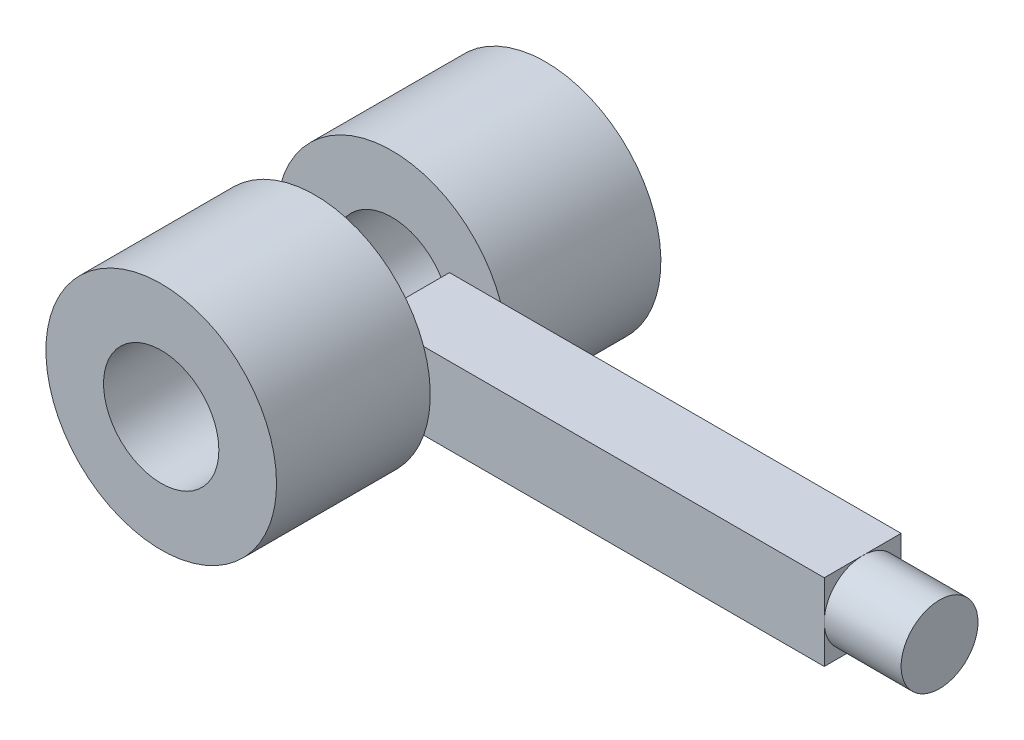
from build123d import *

# Parameters (mm, degrees)
SKETCH1_R           = 3
SKETCH1_R_2         = 1.5
BOSS_EXTRUDE1_DEPTH = 4
SKETCH2_R           = 3
SKETCH2_R_2         = 1.5
BOSS_EXTRUDE2_DEPTH = 4
BOSS_EXTRUDE3_REACH = 9.348
SKETCH3_W           = 1
SKETCH3_H           = 2
SKETCH4_W           = 2
SKETCH4_H           = 2
BOSS_EXTRUDE4_DEPTH = 10.75
SKETCH6_R           = 1
BOSS_EXTRUDE5_DEPTH = 2


with BuildPart() as part:
    # Sketch1 → Boss-Extrude1 (new body)
    with BuildSketch(Plane.XY):
        Circle(SKETCH1_R)
        Circle(SKETCH1_R_2, mode=Mode.SUBTRACT)
    extrude(amount=BOSS_EXTRUDE1_DEPTH)

    # Sketch3 → Boss-Extrude3 (add, up to next)
    with BuildSketch(Plane.XY.offset(-2), mode=Mode.PRIVATE) as boss_extrude3_sk1:
        with Locations((2, 0)):
            Rectangle(SKETCH3_W, SKETCH3_H)
    boss_extrude3_tool1 = extrude(boss_extrude3_sk1.sketch, amount=BOSS_EXTRUDE3_REACH, mode=Mode.PRIVATE) - part.part


with BuildPart() as body_2:
    # Sketch2 → Boss-Extrude2 (new body)
    with BuildSketch(Plane(origin=(0, 0, -2), x_dir=(-1, 0, 0), z_dir=(0, 0, -1))):
        with Locations(Location((0, 0, 0), (0, 0, 180))):
            Circle(SKETCH2_R)
        with Locations(Location((0, 0, 0), (0, 0, 180))):
            Circle(SKETCH2_R_2, mode=Mode.SUBTRACT)
    extrude(amount=BOSS_EXTRUDE2_DEPTH)


with BuildPart() as part_1:
    add(part.part)

    add(body_2.part)  # Boss-Extrude3 merges body 2
    add(boss_extrude3_tool1.solids().sort_by_distance((2, 0, -2))[0])

    # Sketch4 → Boss-Extrude4 (add)
    with BuildSketch(Plane(origin=(2.5, 0, 0), x_dir=(0, 0, -1), z_dir=(1, 0, 0))):
        with Locations((1, 0)):
            Rectangle(SKETCH4_W, SKETCH4_H)
    extrude(amount=BOSS_EXTRUDE4_DEPTH)

    # Sketch6 → Boss-Extrude5 (add)
    with BuildSketch(Plane(origin=(13.25, 0, 0), x_dir=(0, 0, -1), z_dir=(1, 0, 0))):
        with Locations((1, 0)):
            Circle(SKETCH6_R)
    extrude(amount=BOSS_EXTRUDE5_DEPTH)


solid = part_1.part
